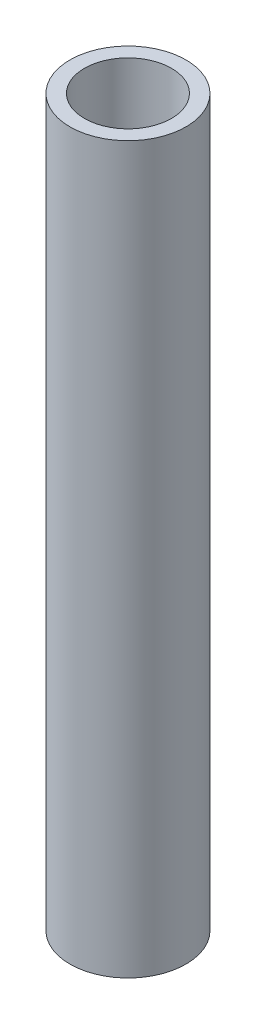
from build123d import *

# Parameters (mm, degrees)
SKETCH1_R           = 8
SKETCH1_R_2         = 6
BOSS_EXTRUDE1_DEPTH = 50


with BuildPart() as part:
    # Sketch1 → Boss-Extrude1 (new, symmetric)
    with BuildSketch(Plane(origin=(0, 0, 0), x_dir=(1, 0, 0), z_dir=(0, 1, 0))):
        with Locations(Location((0, 0, 0), (0, 0, 270))):
            Circle(SKETCH1_R)
        with Locations(Location((0, 0, 0), (0, 0, 270))):
            Circle(SKETCH1_R_2, mode=Mode.SUBTRACT)
    extrude(amount=BOSS_EXTRUDE1_DEPTH, both=True)


solid = part.part
